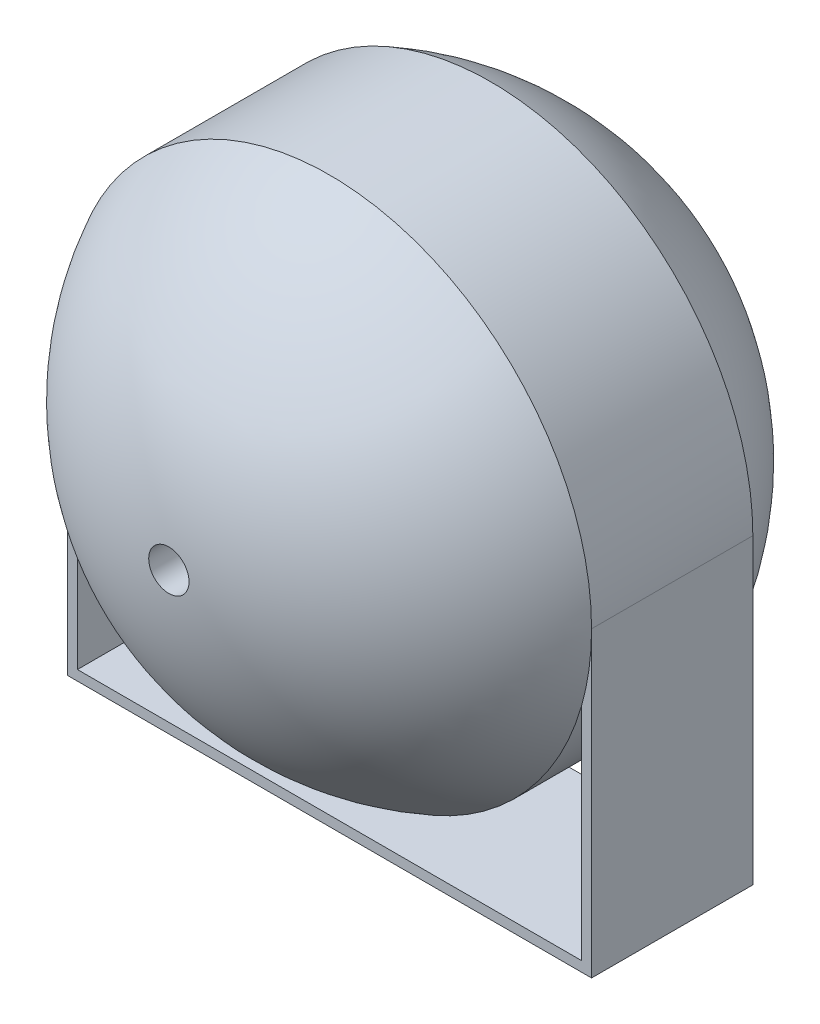
from build123d import *

# Parameters (mm, degrees)
CUT_EXTRUDE1_DEPTH       = 140.411064841
CUT_EXTRUDE1_DEPTH_BACK  = 140.411064841
SKETCH2_R                = 6.35
SKETCH3_W                = 165.1
SKETCH3_H                = 50.8
BOSS_EXTRUDE1_DEPTH      = 3.175
BOSS_EXTRUDE2_REACH      = 209.561
BOSS_EXTRUDE2_END_RADIUS = 82.55
SKETCH5_W                = 3.175
SKETCH5_H                = 50.8


with BuildPart() as part:
    # Sketch1 → Revolve1 (revolve)
    with BuildSketch(Plane(origin=(0, 0, 0), x_dir=(0, 0, -1), z_dir=(1, 0, 0)), mode=Mode.PRIVATE) as revolve1_sk:
        with BuildLine():
            Line((25.4, 82.55), (-25.4, 82.55))
            ThreePointArc((-25.4, 82.55), (-62.482566405, 48.464271634), (-76.2, 0))
            Line((-76.2, 0), (76.2, 0))
            ThreePointArc((76.2, 0), (62.482566405, 48.464271634), (25.4, 82.55))
        make_face()
    revolve(revolve1_sk.sketch.rotate(Axis((0, 0, -76.2), (0, 0, 1)), 90), axis=Axis((0, 0, -76.2), (0, 0, 1)))

    # Sketch2 → Cut-Extrude1 (cut, two sides: drawn at the far end of the back side and taken through both)
    with BuildSketch(Plane.XY.offset(-CUT_EXTRUDE1_DEPTH_BACK)):
        with Locations(Location((0, 0, 0), (0, 0, 90))):
            Circle(SKETCH2_R)
    extrude(amount=CUT_EXTRUDE1_DEPTH + CUT_EXTRUDE1_DEPTH_BACK, mode=Mode.SUBTRACT)



with BuildPart() as body_2:
    # Sketch3 → Boss-Extrude1 (new body)
    with BuildSketch(Plane(origin=(0, -95.25, 0), x_dir=(1, 0, 0), z_dir=(0, 1, 0))):
        Rectangle(SKETCH3_W, SKETCH3_H)
    extrude(amount=BOSS_EXTRUDE1_DEPTH)


with BuildPart() as part_1:
    add(part.part)

    add(body_2.part)  # Boss-Extrude2 merges body 2
    # Boss-Extrude2: up to this cylinder (the profile starts outside it)
    boss_extrude2_end = Plane(origin=(0, 0, 0), z_dir=(0, 0, -1)) * Cylinder(BOSS_EXTRUDE2_END_RADIUS, 585.222, mode=Mode.PRIVATE)
    # Sketch5 → Boss-Extrude2 (add, up to the surface)
    with BuildSketch(Plane(origin=(0, -92.075, 0), x_dir=(1, 0, 0), z_dir=(0, 1, 0)), mode=Mode.PRIVATE) as boss_extrude2_sk1:
        with Locations((80.9625, 0)):
            Rectangle(SKETCH5_W, SKETCH5_H)
    boss_extrude2_tool1 = extrude(boss_extrude2_sk1.sketch, amount=BOSS_EXTRUDE2_REACH, mode=Mode.PRIVATE) - boss_extrude2_end
    add(boss_extrude2_tool1.solids().sort_by_distance((80.9625, -92.075, 0))[0])
    # Sketch5 → Boss-Extrude2 (add, up to the surface)
    with BuildSketch(Plane(origin=(0, -92.075, 0), x_dir=(1, 0, 0), z_dir=(0, 1, 0)), mode=Mode.PRIVATE) as boss_extrude2_sk2:
        with Locations((-80.9625, 0)):
            Rectangle(SKETCH5_W, SKETCH5_H)
    boss_extrude2_tool2 = extrude(boss_extrude2_sk2.sketch, amount=BOSS_EXTRUDE2_REACH, mode=Mode.PRIVATE) - boss_extrude2_end
    add(boss_extrude2_tool2.solids().sort_by_distance((-80.9625, -92.075, 0))[0])


solid = part_1.part
